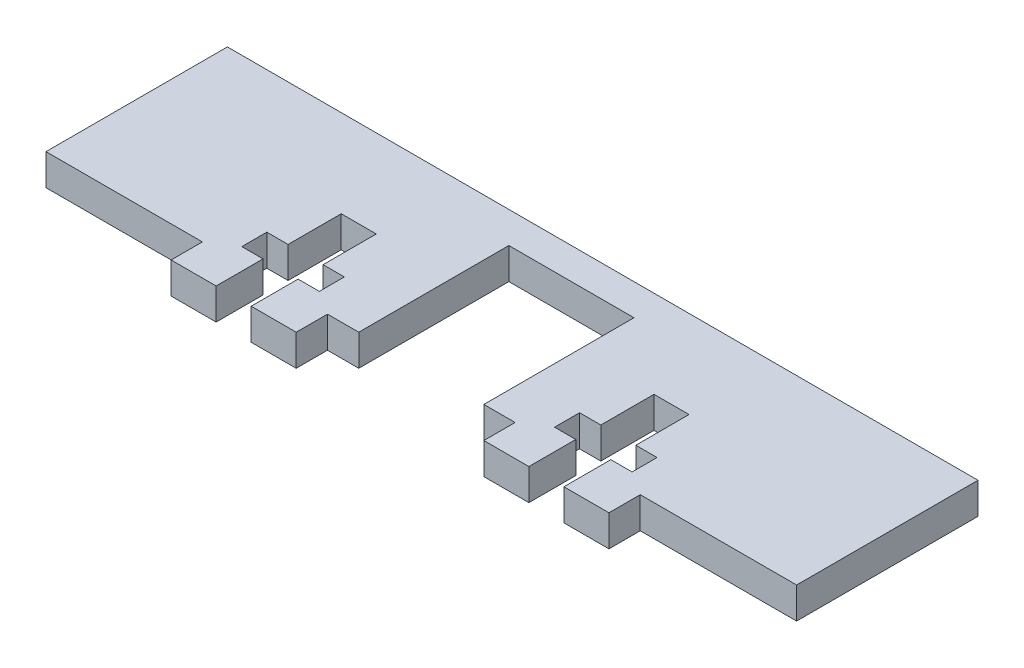
from build123d import *

# Parameters (mm, degrees)
BOSS_EXTRUDE1_DEPTH = 3.175


with BuildPart() as part:
    # Sketch1 → Boss-Extrude1 (new body)
    with BuildSketch(Plane(origin=(0, 0, 0), x_dir=(1, 0, 0), z_dir=(0, 1, 0))):
        Polygon((-9.525, -18.415), (-9.525, -15.24), (-6.35, -15.24), (-6.35, 0), (6.35, 0), (6.35, -15.24), (9.525, -15.24), (9.525, -18.415), (14.097, -18.415), (14.097, -13.6525), (11.938, -13.6525), (11.938, -11.1125), (14.097, -11.1125), (14.097, -5.715), (17.653, -5.715), (17.653, -11.1125), (19.812, -11.1125), (19.812, -13.6525), (17.653, -13.6525), (17.653, -18.415), (22.225, -18.415), (22.225, -15.24), (38.1, -15.24), (38.1, 3.175), (-38.1, 3.175), (-38.1, -15.24), (-22.225, -15.24), (-22.225, -18.415), (-17.653, -18.415), (-17.653, -13.6525), (-19.812, -13.6525), (-19.812, -11.1125), (-17.653, -11.1125), (-17.653, -5.715), (-14.097, -5.715), (-14.097, -11.1125), (-11.938, -11.1125), (-11.938, -13.6525), (-14.097, -13.6525), (-14.097, -18.415), align=None)
    extrude(amount=BOSS_EXTRUDE1_DEPTH)


solid = part.part
